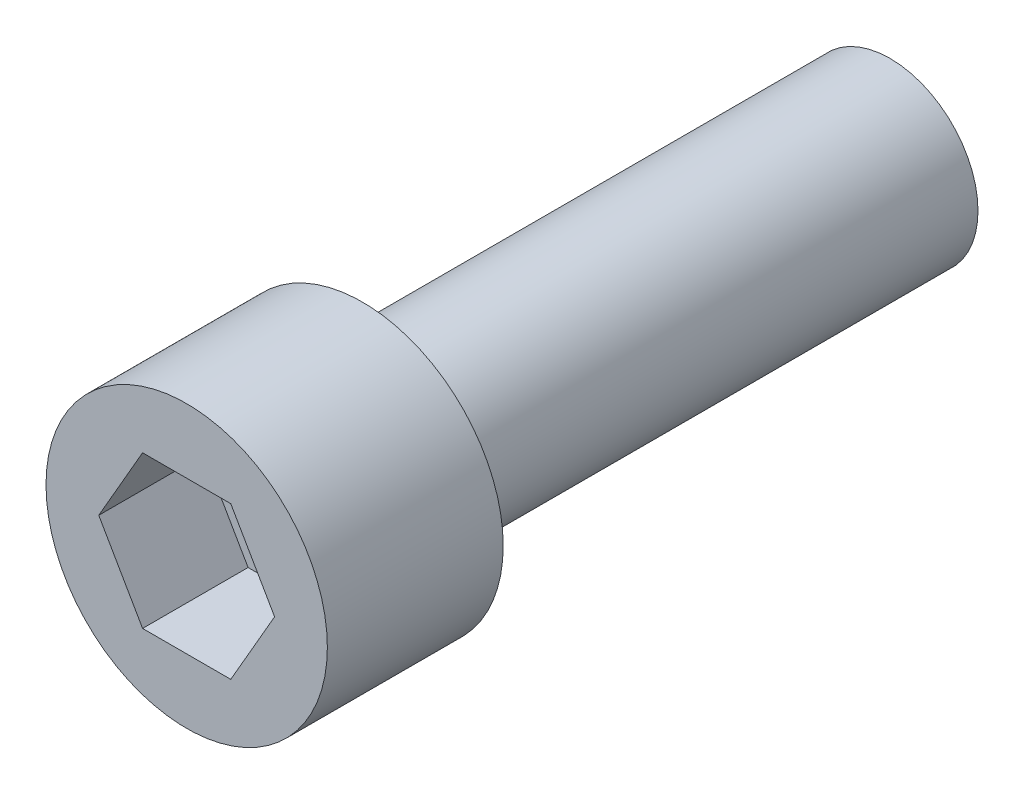
from build123d import *

# Parameters (mm, degrees)
ESQUISSE1_R             = 4
BASE_EXTRUSION_DEPTH    = 5
ENL_V_MAT_EXTRU_1_DEPTH = 3
ESQUISSE4_R             = 2.5
BOSS_EXTRU_3_DEPTH      = 15


with BuildPart() as part:
    # Esquisse1 → Base-Extrusion (new body)
    with BuildSketch(Plane.XY):
        Circle(ESQUISSE1_R)
    extrude(amount=BASE_EXTRUSION_DEPTH)

    # Esquisse3 → Enlèv. mat.-Extru.1 (cut)
    with BuildSketch(Plane.XY.offset(5)):
        Polygon((-2.5, 0), (-1.253634554, 2.162961027), (1.253634554, 2.162961027), (2.5, 0), (1.253634554, -2.162961027), (-1.253634554, -2.162961027), align=None)
    extrude(amount=-ENL_V_MAT_EXTRU_1_DEPTH, mode=Mode.SUBTRACT)

    # Esquisse4 → Boss.-Extru.3 (add)
    with BuildSketch(Plane(origin=(0, 0, 0), x_dir=(-1, 0, 0), z_dir=(0, 0, -1))):
        Circle(ESQUISSE4_R)
    extrude(amount=BOSS_EXTRU_3_DEPTH)


solid = part.part
